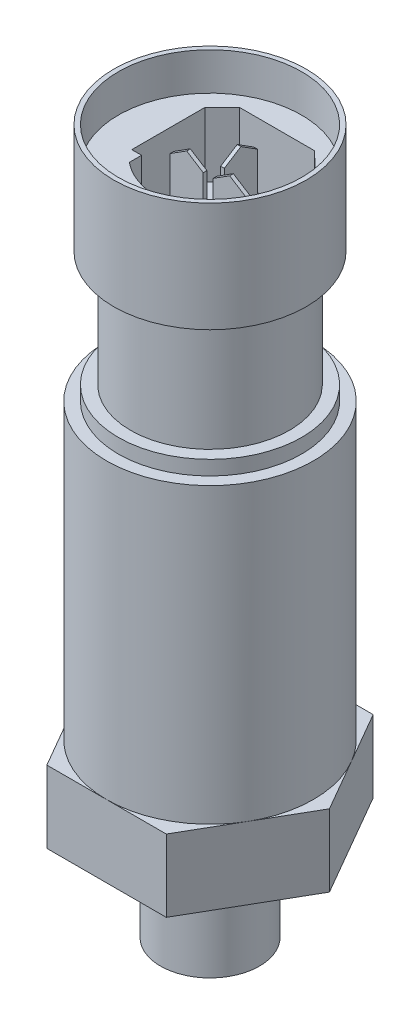
from build123d import *

# Parameters (mm, degrees)
SKETCH1_R           = 5.1435
BOSS_EXTRUDE1_DEPTH = 10.3
BOSS_EXTRUDE2_DEPTH = 7.5
SKETCH3_R           = 10.75
BOSS_EXTRUDE3_DEPTH = 30.48
SKETCH4_R           = 9.525
BOSS_EXTRUDE4_DEPTH = 1.5
SKETCH5_R           = 8.255
BOSS_EXTRUDE5_DEPTH = 12
SKETCH6_R           = 10
BOSS_EXTRUDE6_DEPTH = 11.4
SKETCH7_R           = 4.3053
CUT_EXTRUDE1_DEPTH  = 11.4
SKETCH28_R          = 4.3053
BOSS_EXTRUDE7_DEPTH = 11.4
SKETCH29_R          = 1.5
CUT_EXTRUDE2_DEPTH  = 11.4
CUT_EXTRUDE6_START  = -10.638
SKETCH30_R          = 9.525
CUT_EXTRUDE6_DEPTH  = 10.638
SKETCH31_W          = 0.381
SKETCH31_H          = 3.44369911
SKETCH31_W_2        = 3.44369911
SKETCH31_H_2        = 0.381
BOSS_EXTRUDE8_DEPTH = 7.239
CUT_EXTRUDE7_DEPTH  = 6.731
CUT_EXTRUDE8_DEPTH  = 1.651
CUT_EXTRUDE9_DEPTH  = 1.651
SKETCH35_R          = 9.525
BOSS_EXTRUDE9_DEPTH = 6.731


with BuildPart() as part:
    # Sketch1 → Boss-Extrude1 (new body)
    with BuildSketch(Plane(origin=(0, 0, 0), x_dir=(1, 0, 0), z_dir=(0, 1, 0))):
        with Locations(Location((0, 0, 0), (0, 0, 90))):
            Circle(SKETCH1_R)
    extrude(amount=BOSS_EXTRUDE1_DEPTH)

    # Sketch2 → Boss-Extrude2 (add)
    with BuildSketch(Plane(origin=(0, 10.3, 0), x_dir=(1, 0, 0), z_dir=(0, 1, 0))):
        Polygon((6.206515394, 10.75), (-6.206515394, 10.75), (-12.413030788, 0), (-6.206515394, -10.75), (6.206515394, -10.75), (12.413030788, 0), align=None)
    extrude(amount=BOSS_EXTRUDE2_DEPTH)

    # Sketch3 → Boss-Extrude3 (add)
    with BuildSketch(Plane(origin=(0, 17.8, 0), x_dir=(1, 0, 0), z_dir=(0, 1, 0))):
        with Locations(Location((0, 0, 0), (0, 0, 270))):
            Circle(SKETCH3_R)
    extrude(amount=BOSS_EXTRUDE3_DEPTH)

    # Sketch4 → Boss-Extrude4 (add)
    with BuildSketch(Plane(origin=(0, 48.28, 0), x_dir=(1, 0, 0), z_dir=(0, 1, 0))):
        with Locations(Location((0, 0, 0), (0, 0, 270))):
            Circle(SKETCH4_R)
    extrude(amount=BOSS_EXTRUDE4_DEPTH)

    # Sketch5 → Boss-Extrude5 (add)
    with BuildSketch(Plane(origin=(0, 49.78, 0), x_dir=(1, 0, 0), z_dir=(0, 1, 0))):
        with Locations(Location((0, 0, 0), (0, 0, 270))):
            Circle(SKETCH5_R)
    extrude(amount=BOSS_EXTRUDE5_DEPTH)

    # Sketch6 → Boss-Extrude6 (add)
    with BuildSketch(Plane(origin=(0, 61.78, 0), x_dir=(1, 0, 0), z_dir=(0, 1, 0))):
        with Locations(Location((0, 0, 0), (0, 0, 270))):
            Circle(SKETCH6_R)
    extrude(amount=BOSS_EXTRUDE6_DEPTH)

    # Sketch7 → Cut-Extrude1 (cut)
    with BuildSketch(Plane.XZ):
        with Locations(Location((0, 0, 0), (0, 0, 270))):
            Circle(SKETCH7_R)
    extrude(amount=-CUT_EXTRUDE1_DEPTH, mode=Mode.SUBTRACT)

    # Sketch28 → Boss-Extrude7 (add)
    with BuildSketch(Plane(origin=(0, 0, 0), x_dir=(-1, 0, 0), z_dir=(0, -1, 0))):
        Circle(SKETCH28_R)
    extrude(amount=-BOSS_EXTRUDE7_DEPTH)

    # Sketch29 → Cut-Extrude2 (cut)
    with BuildSketch(Plane.XZ):
        with Locations(Location((0, 0, 0), (0, 0, 270))):
            Circle(SKETCH29_R)
    extrude(amount=-CUT_EXTRUDE2_DEPTH, mode=Mode.SUBTRACT)

    # Sketch30 → Cut-Extrude6 (cut)
    with BuildSketch(Plane(origin=(0, 73.18, 0), x_dir=(1, 0, 0), z_dir=(0, 1, 0)).offset(CUT_EXTRUDE6_START)):
        with Locations(Location((0, 0, 0), (0, 0, 270))):
            Circle(SKETCH30_R)
    extrude(amount=CUT_EXTRUDE6_DEPTH, mode=Mode.SUBTRACT)

    # Sketch31 → Boss-Extrude8 (add)
    with BuildSketch(Plane(origin=(0, 62.542, 0), x_dir=(1, 0, 0), z_dir=(0, 1, 0))):
        with Locations((0, 3.0226)):
            Rectangle(SKETCH31_W, SKETCH31_H)
        with Locations((-2.2352, 0)):
            Rectangle(SKETCH31_W_2, SKETCH31_H_2)
        with Locations((2.2352, 0)):
            Rectangle(SKETCH31_W_2, SKETCH31_H_2)
    extrude(amount=BOSS_EXTRUDE8_DEPTH)

    # Sketch32 → Cut-Extrude7 (cut)
    with BuildSketch(Plane.XY.offset(0.1905)):
        Polygon((-3.957049555, 68.6888), (-2.2352, 69.781), (-3.957049555, 69.781), align=None)
        Polygon((-0.513350445, 69.781), (-2.2352, 69.781), (-0.513350445, 68.6888), align=None)
    extrude(amount=-CUT_EXTRUDE7_DEPTH, mode=Mode.SUBTRACT)

    # Sketch33 → Cut-Extrude8 (cut)
    with BuildSketch(Plane.XY.offset(0.1905)):
        Polygon((0.513350445, 68.6888), (2.2352, 69.781), (0.513350445, 69.781), align=None)
        Polygon((3.957049555, 69.781), (2.2352, 69.781), (3.957049555, 68.6888), align=None)
    extrude(amount=-CUT_EXTRUDE8_DEPTH, mode=Mode.SUBTRACT)

    # Sketch34 → Cut-Extrude9 (cut)
    with BuildSketch(Plane(origin=(0.1905, 0, 0), x_dir=(0, 0, -1), z_dir=(1, 0, 0))):
        Polygon((1.300750445, 68.6888), (3.0226, 69.781), (1.300750445, 69.781), align=None)
        Polygon((4.744449555, 69.781), (3.0226, 69.781), (4.744449555, 68.6888), align=None)
    extrude(amount=-CUT_EXTRUDE9_DEPTH, mode=Mode.SUBTRACT)

    # Sketch35 → Boss-Extrude9 (add)
    with BuildSketch(Plane(origin=(0, 62.542, 0), x_dir=(1, 0, 0), z_dir=(0, 1, 0))):
        with Locations(Location((0, 0, 0), (0, 0, 270))):
            Circle(SKETCH35_R)
        with BuildLine():
            ThreePointArc((-4.699, -3.683), (-0.167968835, -5.324730553), (4.363062329, -3.683))
            Line((4.363062329, -3.683), (4.363062329, -2.413))
            Line((4.363062329, -2.413), (5.715, -2.413))
            Line((5.715, -2.413), (5.715, 5.24229274))
            Line((5.715, 5.24229274), (3.860385896, 6.985))
            Line((3.860385896, 6.985), (-3.918948776, 6.985))
            Line((-3.918948776, 6.985), (-5.715, 5.188948776))
            Line((-5.715, 5.188948776), (-5.715, -2.413))
            Line((-5.715, -2.413), (-4.699, -2.413))
            Line((-4.699, -2.413), (-4.699, -3.683))
        make_face(mode=Mode.SUBTRACT)
    extrude(amount=BOSS_EXTRUDE9_DEPTH)


solid = part.part
